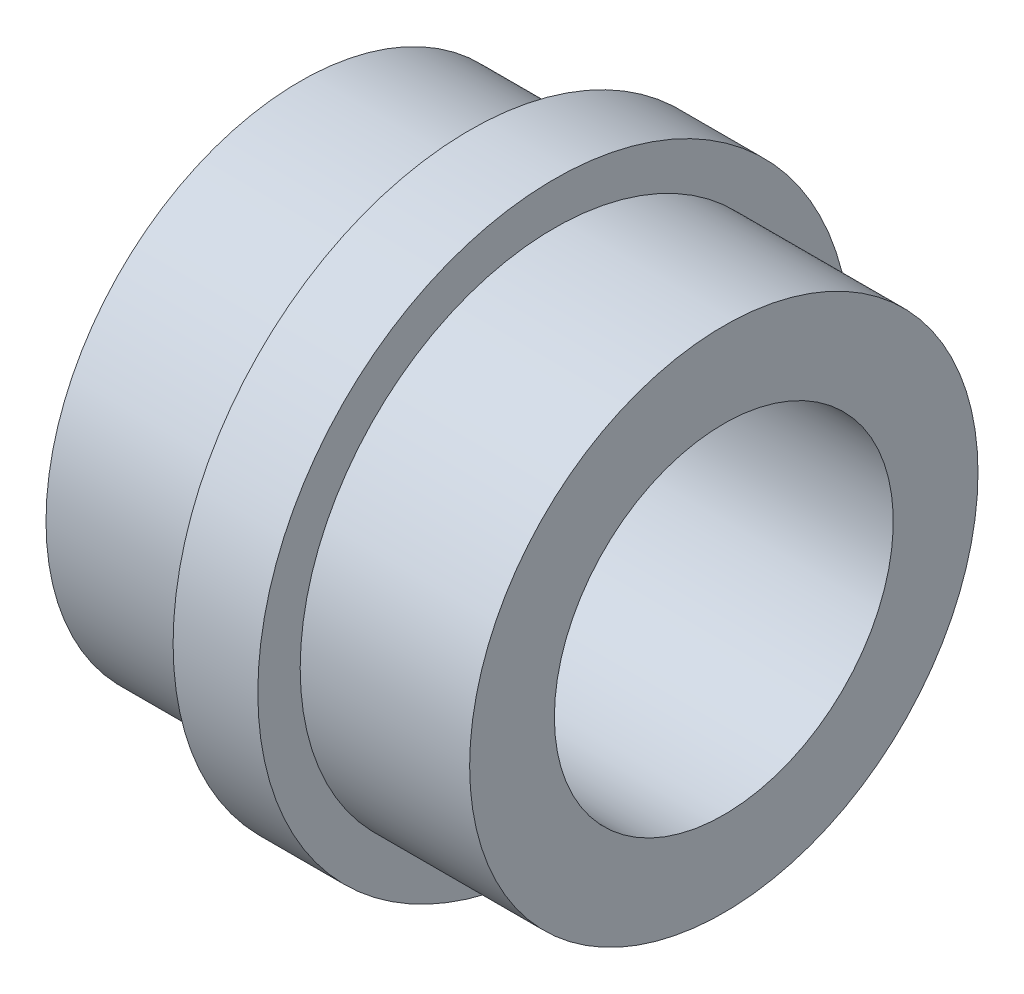
from build123d import *


with BuildPart() as part:
    # Sketch2 → Revolve1 (revolve)
    with BuildSketch(Plane(origin=(0, 0, 0), x_dir=(1, 0, 0), z_dir=(0, 1, 0)), mode=Mode.PRIVATE) as revolve1_sk:
        Polygon((30, 30), (50, 30), (50, 20), (0, 20), (0, 30), (20, 30), (20, 35), (30, 35), align=None)
    revolve(revolve1_sk.sketch.rotate(Axis((0, 0, 0), (1, 0, 0)), 180), axis=Axis((0, 0, 0), (1, 0, 0)))


solid = part.part
